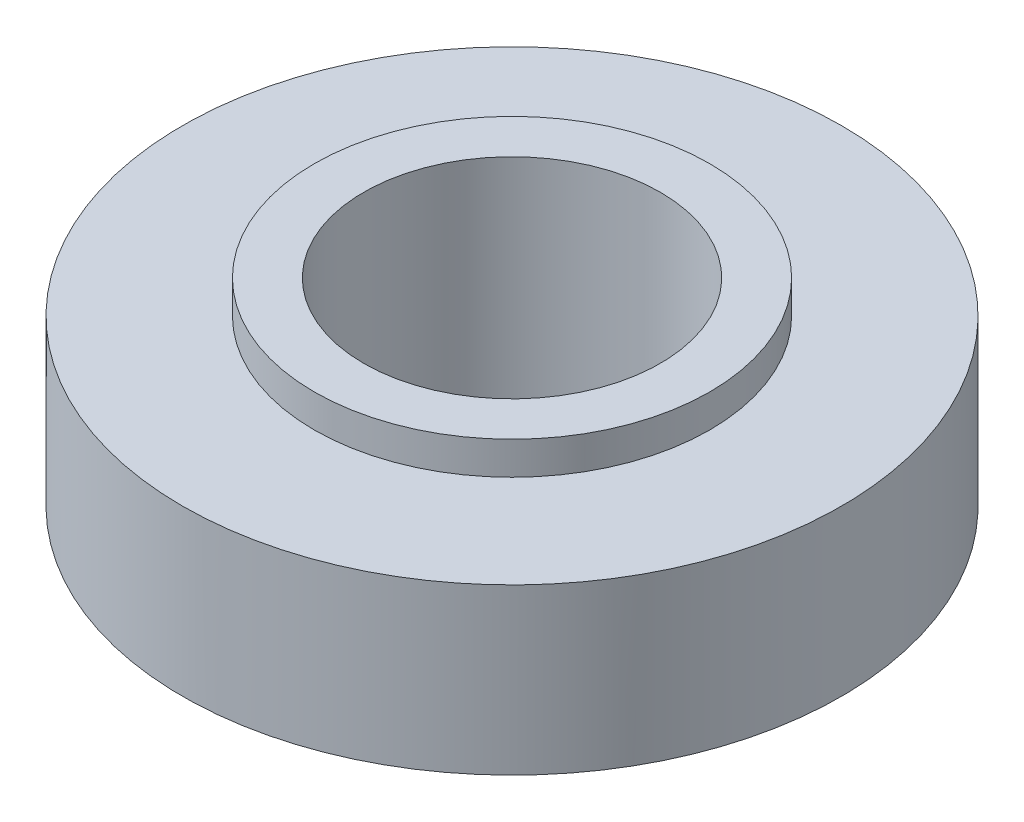
from build123d import *

# Parameters (mm, degrees)
SKETCH2_R           = 10
SKETCH2_R_2         = 4.5
BOSS_EXTRUDE1_DEPTH = 3.5
SKETCH3_R           = 13
SKETCH3_R_2         = 6
CUT_EXTRUDE1_DEPTH  = 1


with BuildPart() as part:
    # Sketch2 → Boss-Extrude1 (new, symmetric)
    with BuildSketch(Plane(origin=(0, 0, 0), x_dir=(1, 0, 0), z_dir=(0, 1, 0))):
        with Locations(Location((0, 0, 0), (0, 0, 270))):
            Circle(SKETCH2_R)
        with Locations(Location((0, 0, 0), (0, 0, 270))):
            Circle(SKETCH2_R_2, mode=Mode.SUBTRACT)
    extrude(amount=BOSS_EXTRUDE1_DEPTH, both=True)

    # Sketch3 → Cut-Extrude1 (cut)
    with BuildSketch(Plane(origin=(0, 3.5, 0), x_dir=(1, 0, 0), z_dir=(0, 1, 0))):
        Circle(SKETCH3_R)
        with Locations(Location((0, 0, 0), (0, 0, 270))):
            Circle(SKETCH3_R_2, mode=Mode.SUBTRACT)
    cut_extrude1 = extrude(amount=-CUT_EXTRUDE1_DEPTH, mode=Mode.SUBTRACT)

    # Mirror3: Cut-Extrude1 across plane
    add(cut_extrude1.mirror(Plane.ZX), mode=Mode.SUBTRACT)


solid = part.part
